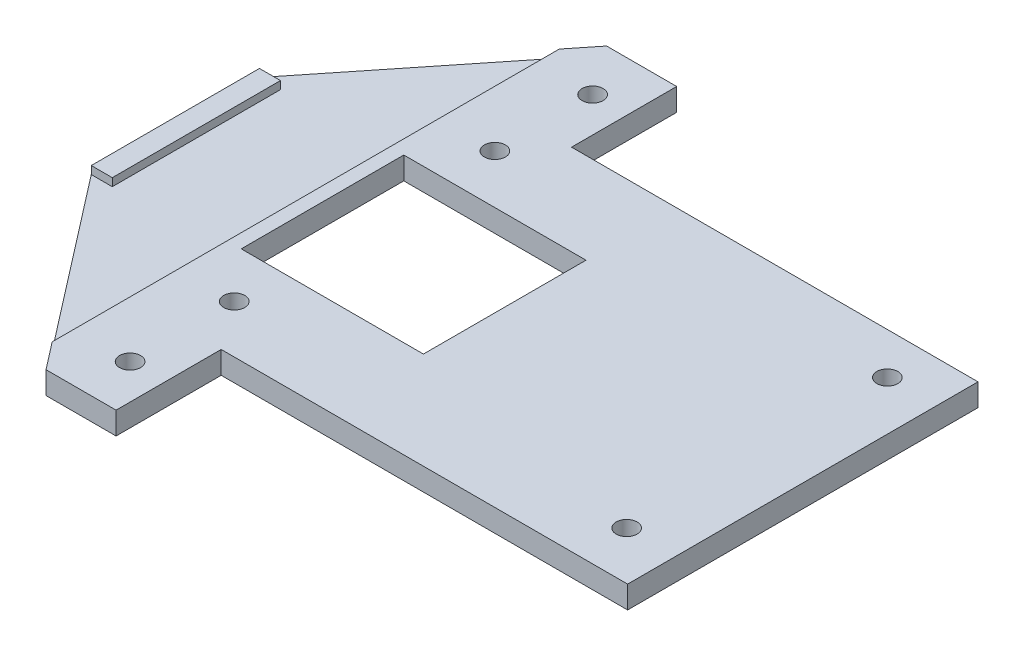
from build123d import *

# Parameters (mm, degrees)
BOSS_EXTRUDE1_DEPTH = 1.6
CUT_EXTRUDE1_DEPTH  = 0.56
SKETCH3_W           = 13
SKETCH3_H           = 11.6
CUT_EXTRUDE2_DEPTH  = 2
SKETCH4_R           = 0.75
CUT_EXTRUDE3_DEPTH  = 2


with BuildPart() as part:
    # Sketch1 → Boss-Extrude1 (new body)
    with BuildSketch(Plane(origin=(0, 0, 0), x_dir=(1, 0, 0), z_dir=(0, 1, 0))):
        Polygon((0, 6), (0, -6), (11, -20.23), (16, -20.23), (16, -12.73), (45, -12.73), (45, 12.27), (16, 12.27), (16, 19.77), (11, 19.77), align=None)
    extrude(amount=BOSS_EXTRUDE1_DEPTH)

    # Sketch2 → Cut-Extrude1 (cut)
    with BuildSketch(Plane(origin=(0, 1.6, 0), x_dir=(1, 0, 0), z_dir=(0, 1, 0))):
        Polygon((0, -6), (9.5, -18.289545455), (9.5, 17.892272727), (0, 6), (1.5, 6), (1.5, -6), align=None)
    extrude(amount=-CUT_EXTRUDE1_DEPTH, mode=Mode.SUBTRACT)

    # Sketch3 → Cut-Extrude2 (cut)
    with BuildSketch(Plane(origin=(0, 1.6, 0), x_dir=(1, 0, 0), z_dir=(0, 1, 0))):
        with Locations((17, 0)):
            Rectangle(SKETCH3_W, SKETCH3_H)
    extrude(amount=-CUT_EXTRUDE2_DEPTH, mode=Mode.SUBTRACT)

    # Sketch4 → Cut-Extrude3 (cut)
    with BuildSketch(Plane(origin=(0, 1.6, 0), x_dir=(1, 0, 0), z_dir=(0, 1, 0))):
        with Locations(Location((13.5, 16.27, 0), (0, 0, 270))):
            Circle(SKETCH4_R)
        with Locations(Location((13.5, 9.3, 0), (0, 0, 270))):
            Circle(SKETCH4_R)
        with Locations(Location((41.5, 9.3, 0), (0, 0, 270))):
            Circle(SKETCH4_R)
        with Locations(Location((41.5, -9.3, 0), (0, 0, 270))):
            Circle(SKETCH4_R)
        with Locations(Location((13.5, -9.3, 0), (0, 0, 270))):
            Circle(SKETCH4_R)
        with Locations(Location((13.5, -16.73, 0), (0, 0, 270))):
            Circle(SKETCH4_R)
    extrude(amount=-CUT_EXTRUDE3_DEPTH, mode=Mode.SUBTRACT)


solid = part.part
